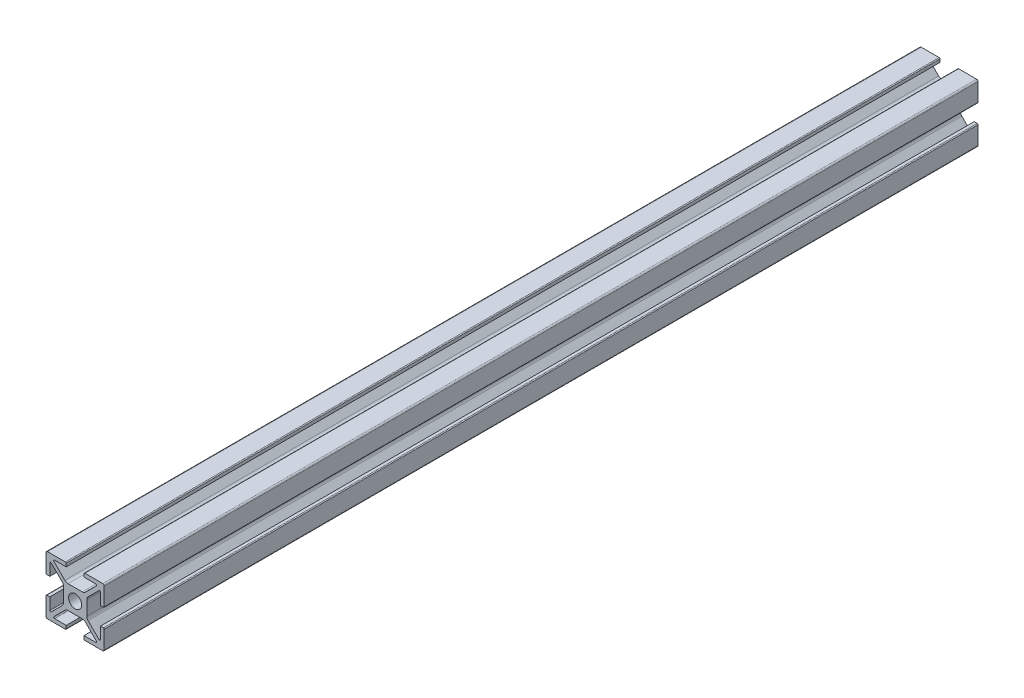
from build123d import *

# Parameters (mm, degrees)
ESBO_O11_R                                   = 2.25
QUADRADO_PF20_21_PERFIL_2020_T_SLOT_6M_DEPTH = 300


with BuildPart() as part:
    # Esboço11 → Quadrado PF20-21 - PERFIL 2020 T-SLOT 6MM(1) (new body)
    with BuildSketch(Plane(origin=(0, 0, 0), x_dir=(0, -1, 0), z_dir=(0, 0, 1))):
        with BuildLine():
            Line((8.187867966, -7.26862915), (4.439339828, -3.520101013))
            ThreePointArc((4.439339828, -3.520101013), (4.114180701, -3.033465989), (4, -2.459440841))
            Line((4, -2.459440841), (4, 2.459440841))
            ThreePointArc((4, 2.459440841), (4.114180701, 3.033465989), (4.439339828, 3.520101013))
            Line((4.439339828, 3.520101013), (8.187867966, 7.26862915))
            ThreePointArc((8.187867966, 7.26862915), (8.51480503, 7.333660975), (8.7, 7.056497116))
            Line((8.7, 7.056497116), (8.7, 3.05))
            Line((8.7, 3.05), (9.7, 3.05))
            ThreePointArc((9.7, 3.05), (9.912132034, 3.137867966), (10, 3.35))
            Line((10, 3.35), (10, 9.5))
            ThreePointArc((10, 9.5), (9.853553391, 9.853553391), (9.5, 10))
            Line((9.5, 10), (3.35, 10))
            ThreePointArc((3.35, 10), (3.137867966, 9.912132034), (3.05, 9.7))
            Line((3.05, 9.7), (3.05, 8.7))
            Line((3.05, 8.7), (7.056497116, 8.7))
            ThreePointArc((7.056497116, 8.7), (7.333660975, 8.51480503), (7.26862915, 8.187867966))
            Line((7.26862915, 8.187867966), (3.520101013, 4.439339828))
            ThreePointArc((3.520101013, 4.439339828), (3.033465989, 4.114180701), (2.459440841, 4))
            Line((2.459440841, 4), (-2.459440841, 4))
            ThreePointArc((-2.459440841, 4), (-3.033465989, 4.114180701), (-3.520101013, 4.439339828))
            Line((-3.520101013, 4.439339828), (-7.26862915, 8.187867966))
            ThreePointArc((-7.26862915, 8.187867966), (-7.333660975, 8.51480503), (-7.056497116, 8.7))
            Line((-7.056497116, 8.7), (-3.05, 8.7))
            Line((-3.05, 8.7), (-3.05, 9.7))
            ThreePointArc((-3.05, 9.7), (-3.137867966, 9.912132034), (-3.35, 10))
            Line((-3.35, 10), (-9.5, 10))
            ThreePointArc((-9.5, 10), (-9.853553391, 9.853553391), (-10, 9.5))
            Line((-10, 9.5), (-10, 3.35))
            ThreePointArc((-10, 3.35), (-9.912132034, 3.137867966), (-9.7, 3.05))
            Line((-9.7, 3.05), (-8.7, 3.05))
            Line((-8.7, 3.05), (-8.7, 7.056497116))
            ThreePointArc((-8.7, 7.056497116), (-8.51480503, 7.333660975), (-8.187867966, 7.26862915))
            Line((-8.187867966, 7.26862915), (-4.439339828, 3.520101013))
            ThreePointArc((-4.439339828, 3.520101013), (-4.114180701, 3.033465989), (-4, 2.459440841))
            Line((-4, 2.459440841), (-4, -2.459440841))
            ThreePointArc((-4, -2.459440841), (-4.114180701, -3.033465989), (-4.439339828, -3.520101013))
            Line((-4.439339828, -3.520101013), (-8.187867966, -7.26862915))
            ThreePointArc((-8.187867966, -7.26862915), (-8.51480503, -7.333660975), (-8.7, -7.056497116))
            Line((-8.7, -7.056497116), (-8.7, -3.05))
            Line((-8.7, -3.05), (-9.7, -3.05))
            ThreePointArc((-9.7, -3.05), (-9.912132034, -3.137867966), (-10, -3.35))
            Line((-10, -3.35), (-10, -9.5))
            ThreePointArc((-10, -9.5), (-9.853553391, -9.853553391), (-9.5, -10))
            Line((-9.5, -10), (-3.35, -10))
            ThreePointArc((-3.35, -10), (-3.137867966, -9.912132034), (-3.05, -9.7))
            Line((-3.05, -9.7), (-3.05, -8.7))
            Line((-3.05, -8.7), (-7.056497116, -8.7))
            ThreePointArc((-7.056497116, -8.7), (-7.333660975, -8.51480503), (-7.26862915, -8.187867966))
            Line((-7.26862915, -8.187867966), (-3.520101013, -4.439339828))
            ThreePointArc((-3.520101013, -4.439339828), (-3.033465989, -4.114180701), (-2.459440841, -4))
            Line((-2.459440841, -4), (2.459440841, -4))
            ThreePointArc((2.459440841, -4), (3.033465989, -4.114180701), (3.520101013, -4.439339828))
            Line((3.520101013, -4.439339828), (7.26862915, -8.187867966))
            ThreePointArc((7.26862915, -8.187867966), (7.333660975, -8.51480503), (7.056497116, -8.7))
            Line((7.056497116, -8.7), (3.05, -8.7))
            Line((3.05, -8.7), (3.05, -9.7))
            ThreePointArc((3.05, -9.7), (3.137867966, -9.912132034), (3.35, -10))
            Line((3.35, -10), (9.5, -10))
            ThreePointArc((9.5, -10), (9.853553391, -9.853553391), (10, -9.5))
            Line((10, -9.5), (10, -3.35))
            ThreePointArc((10, -3.35), (9.912132034, -3.137867966), (9.7, -3.05))
            Line((9.7, -3.05), (8.7, -3.05))
            Line((8.7, -3.05), (8.7, -7.056497116))
            ThreePointArc((8.7, -7.056497116), (8.51480503, -7.333660975), (8.187867966, -7.26862915))
        make_face()
        Circle(ESBO_O11_R, mode=Mode.SUBTRACT)
    extrude(amount=QUADRADO_PF20_21_PERFIL_2020_T_SLOT_6M_DEPTH)


solid = part.part
